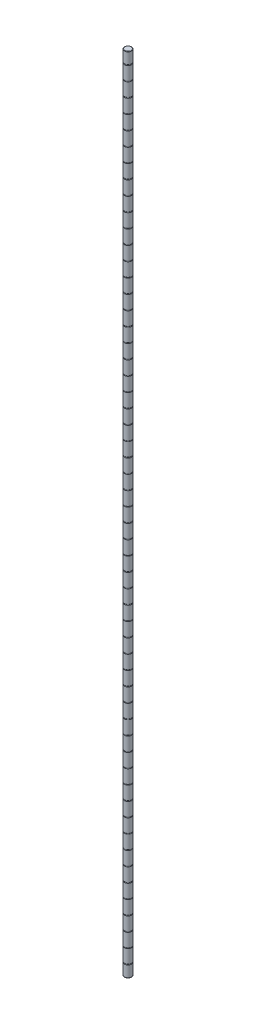
from build123d import *

# Parameters (mm, degrees)
CROQUIS1_R                                           = 7.5
SALIENTE_EXTRUIR1_DEPTH                              = 1700
CROQUIS2_R                                           = 0.875
MATRIZL1_COUNT                                       = 56
MATRIZL1_PITCH                                       = 30
REDONDEO1_R                                          = 1
REFRENTADO_PARA_TORNILLO_CON_CABEZA_PLAN_D           = 5.5
REFRENTADO_PARA_TORNILLO_CON_CABEZA_PLAN_DEPTH       = 40
REFRENTADO_PARA_TORNILLO_CON_CABEZA_PLAN_CBORE_D     = 10
REFRENTADO_PARA_TORNILLO_CON_CABEZA_PLAN_CBORE_DEPTH = 3.3
REFRENTADO_PARA_TORNILLO_CON_CABEZA_PLAN_TIP         = 1.652366702


with BuildPart() as part:
    # Croquis1 → Saliente-Extruir1 (new body)
    with BuildSketch(Plane(origin=(0, 0, 0), x_dir=(1, 0, 0), z_dir=(0, 1, 0))):
        with Locations(Location((0, 0, 0), (0, 0, 270))):
            Circle(CROQUIS1_R)
    extrude(amount=SALIENTE_EXTRUIR1_DEPTH)

    # Croquis2 → Cortar-Revolución1 (revolve, cut)
    with BuildSketch(Plane.XY, mode=Mode.PRIVATE) as cortar_revoluci_n1_sk:
        with Locations((7.9, 25)):
            Circle(CROQUIS2_R)
    cortar_revoluci_n1 = revolve(cortar_revoluci_n1_sk.sketch.rotate(Axis((0, 0, 0), (0, 1, 0)), 90), axis=Axis((0, 0, 0), (0, 1, 0)), mode=Mode.SUBTRACT)

    # MatrizL1: Cortar-Revolución1 ×56
    with Locations(*[(0, i * MATRIZL1_PITCH, 0) for i in range(1, MATRIZL1_COUNT)]):
        add(cortar_revoluci_n1, mode=Mode.SUBTRACT)

    # Redondeo1
    redondeo1_edges = [part.edges().sort_by_distance(p)[0] for p in [
        (0, 0, -7.5),
        (0, 1700, -7.5),
    ]]
    fillet(redondeo1_edges, radius=REDONDEO1_R)

    # Refrentado para tornillo con cabeza plana de M51
    with Locations(Plane(origin=(0, 0, 0), x_dir=(-1, 0, 0), z_dir=(0, -1, 0))):
        with Locations((0, 0)):
            CounterBoreHole(REFRENTADO_PARA_TORNILLO_CON_CABEZA_PLAN_D / 2, REFRENTADO_PARA_TORNILLO_CON_CABEZA_PLAN_CBORE_D / 2, REFRENTADO_PARA_TORNILLO_CON_CABEZA_PLAN_CBORE_DEPTH, depth=REFRENTADO_PARA_TORNILLO_CON_CABEZA_PLAN_DEPTH)
            with Locations((0, 0, -(REFRENTADO_PARA_TORNILLO_CON_CABEZA_PLAN_DEPTH + REFRENTADO_PARA_TORNILLO_CON_CABEZA_PLAN_TIP / 2))):  # 118° drill point
                Cone(0, REFRENTADO_PARA_TORNILLO_CON_CABEZA_PLAN_D / 2, REFRENTADO_PARA_TORNILLO_CON_CABEZA_PLAN_TIP, mode=Mode.SUBTRACT)


solid = part.part
